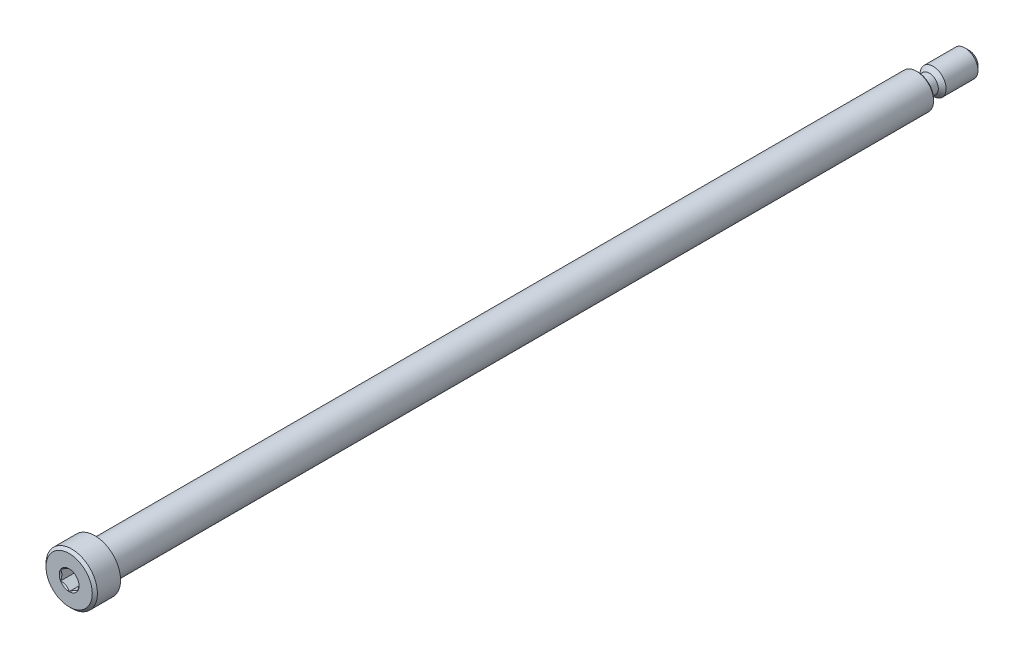
from build123d import *

# Parameters (mm, degrees)
CUT_EXTRUDE1_DEPTH = 3.571875


with BuildPart() as part:
    # Sketch4 → Revolve1 (revolve)
    with BuildSketch(Plane(origin=(0, 0, 0), x_dir=(0, 0, -1), z_dir=(1, 0, 0))):
        Polygon((-78.58125, 4.7625), (-82.8675, 4.7625), (-83.34375, 4.28625), (-83.34375, 0), (73.81875, 0), (73.81875, 2.921), (73.56475, 3.175), (-78.58125, 3.175), align=None)
    revolve(axis=Axis((0, 0, 83.34375), (0, 0, -1)))

    # Sketch5 → Cut-Extrude1 (cut)
    with BuildSketch(Plane.XY.offset(83.34375)):
        Polygon((1.5875, 0.916543552), (0, 1.833087105), (-1.5875, 0.916543552), (-1.5875, -0.916543552), (0, -1.833087105), (1.5875, -0.916543552), align=None)
    extrude(amount=-CUT_EXTRUDE1_DEPTH, mode=Mode.SUBTRACT)

    # Cut-Extrude4 cone 1 section (through the dimple's axis) → Cut-Extrude4 (revolve, cut)
    with BuildSketch(Plane(origin=(0, 0, 83.34375), x_dir=(0, -1, 0), z_dir=(1, 0, 0))):
        Polygon((0, 0), (1.833087105, 0), (0, 1.833087105), align=None)
    revolve(axis=Axis((0, 0, 83.34375), (0, 0, -1)), mode=Mode.SUBTRACT)

    # Sketch7 → Revolve2 (revolve)
    with BuildSketch(Plane(origin=(0, 0, 0), x_dir=(0, 0, -1), z_dir=(1, 0, 0))):
        Polygon((73.81875, 2.413), (82.55, 2.413), (83.34375, 1.61925), (83.34375, 0), (73.81875, 0), align=None)
    revolve(axis=Axis((0, 0, -83.34375), (0, 0, 1)))

    # Sketch10 → Cut-Revolve1 (revolve, cut)
    with BuildSketch(Plane(origin=(0, 0, 0), x_dir=(0, 0, -1), z_dir=(1, 0, 0))):
        with BuildLine():
            Line((74.54265, 1.6891), (75.92695, 1.6891))
            Line((75.92695, 1.6891), (77.41285, 3.175))
            Line((77.41285, 3.175), (73.81875, 3.175))
            Line((73.81875, 3.175), (73.81875, 2.413))
            ThreePointArc((73.81875, 2.413), (74.030775401, 1.901125401), (74.54265, 1.6891))
        make_face()
    revolve(axis=Axis((0, 0, -83.34375), (0, 0, 1)), mode=Mode.SUBTRACT)


solid = part.part
